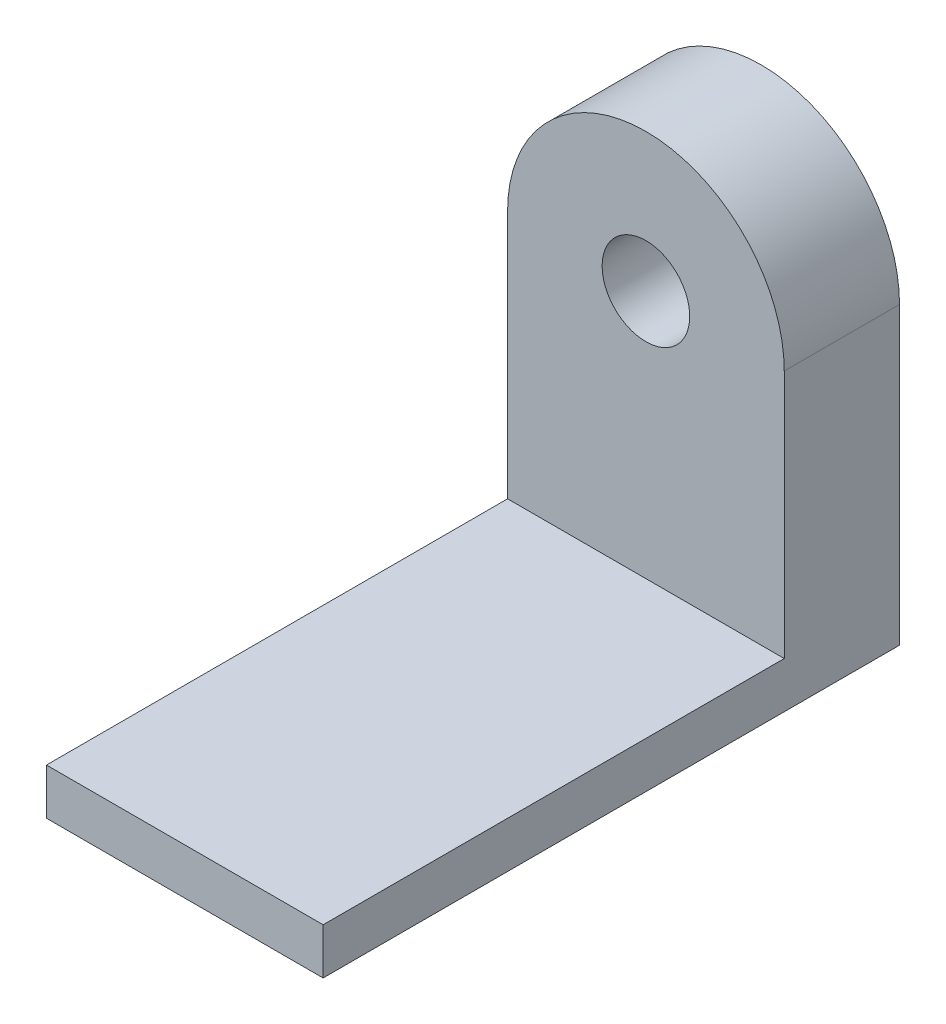
from build123d import *

# Parameters (mm, degrees)
SKETCH1_W           = 60
SKETCH1_H           = 125
BOSS_EXTRUDE1_DEPTH = 10
SKETCH2_R           = 9.5
BOSS_EXTRUDE2_DEPTH = 25


with BuildPart() as part:
    # Sketch1 → Boss-Extrude1 (new body)
    with BuildSketch(Plane(origin=(0, 0, 0), x_dir=(1, 0, 0), z_dir=(0, 1, 0))):
        with Locations((30, 62.5)):
            Rectangle(SKETCH1_W, SKETCH1_H)
    extrude(amount=BOSS_EXTRUDE1_DEPTH)

    # Sketch2 → Boss-Extrude2 (add)
    with BuildSketch(Plane(origin=(0, 0, -125), x_dir=(-1, 0, 0), z_dir=(0, 0, -1))):
        with BuildLine():
            Line((-60, 10), (0, 10))
            Line((0, 10), (0, 64))
            ThreePointArc((0, 64), (-30, 94), (-60, 64))
            Line((-60, 64), (-60, 10))
        make_face()
        with Locations((-30, 64)):
            Circle(SKETCH2_R, mode=Mode.SUBTRACT)
    extrude(amount=-BOSS_EXTRUDE2_DEPTH)


solid = part.part
